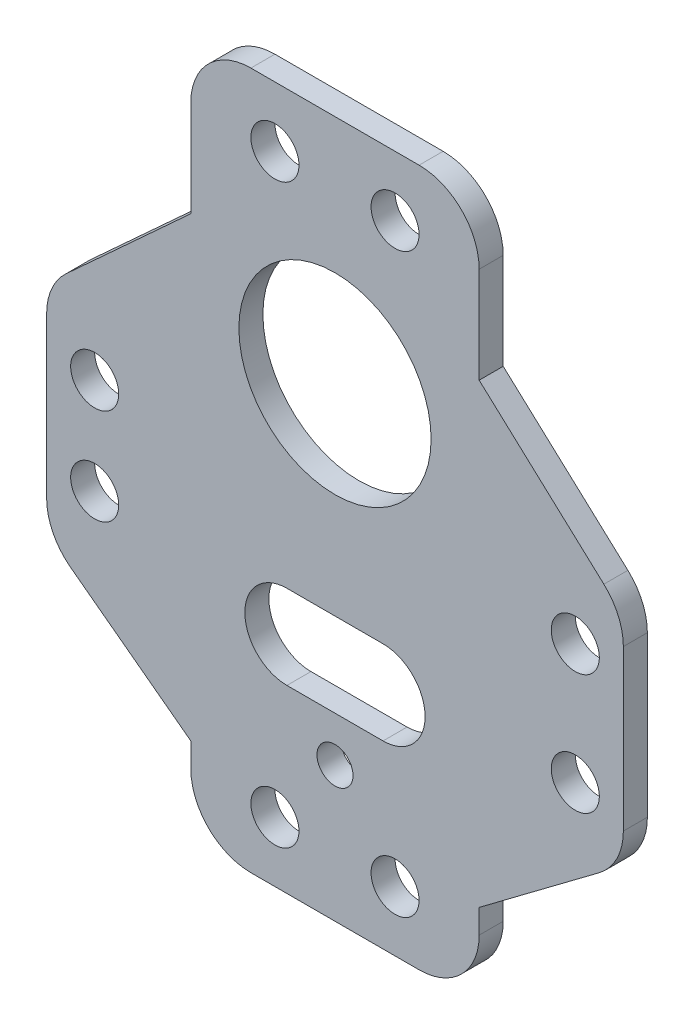
from build123d import *

# Parameters (mm, degrees)
SKETCH_1_R      = 1.5
SKETCH_1_R_2    = 8
SKETCH_1_R_3    = 2
EXTRUDE_1_DEPTH = 2
FILLET_1_R      = 5


with BuildPart() as part:
    # 草图1 → 凸台-拉伸1 (new body)
    with BuildSketch(Plane.XY):
        Polygon((20, -19), (-4, -19), (-4, -32), (-16, -43), (-16, -61), (-4, -70), (-4, -77), (20, -77), (20, -70), (32, -61), (32, -43), (20, -32), align=None)
        with Locations((8, -65.75)):
            Circle(SKETCH_1_R, mode=Mode.SUBTRACT)
        with Locations((8, -38.25)):
            Circle(SKETCH_1_R_2, mode=Mode.SUBTRACT)
        with Locations((3, -72)):
            Circle(SKETCH_1_R_3, mode=Mode.SUBTRACT)
        with Locations((13, -72)):
            Circle(SKETCH_1_R_3, mode=Mode.SUBTRACT)
        with Locations((-12, -48)):
            Circle(SKETCH_1_R_3, mode=Mode.SUBTRACT)
        with Locations((-12, -56)):
            Circle(SKETCH_1_R_3, mode=Mode.SUBTRACT)
        with Locations(Location((28, -57, 0), (0, 0, 180))):
            Circle(SKETCH_1_R_3, mode=Mode.SUBTRACT)
        with Locations(Location((28, -47, 0), (0, 0, 180))):
            Circle(SKETCH_1_R_3, mode=Mode.SUBTRACT)
        with Locations((3, -24)):
            Circle(SKETCH_1_R_3, mode=Mode.SUBTRACT)
        with Locations((13, -24)):
            Circle(SKETCH_1_R_3, mode=Mode.SUBTRACT)
        with BuildLine():
            Line((4, -55), (12, -55))
            ThreePointArc((12, -55), (15.5, -58.5), (12, -62))
            Line((12, -62), (4, -62))
            ThreePointArc((4, -62), (0.5, -58.5), (4, -55))
        make_face(mode=Mode.SUBTRACT)
    extrude(amount=EXTRUDE_1_DEPTH)

    # 圆角1
    fillet_1_edges = [part.edges().sort_by_distance(p)[0] for p in [
        (32, -43, 1),
        (20, -19, 1),
        (-4, -19, 1),
        (-16, -43, 1),
        (-16, -61, 1),
        (-4, -77, 1),
        (20, -77, 1),
        (32, -61, 1),
    ]]
    fillet(fillet_1_edges, radius=FILLET_1_R)


solid = part.part
